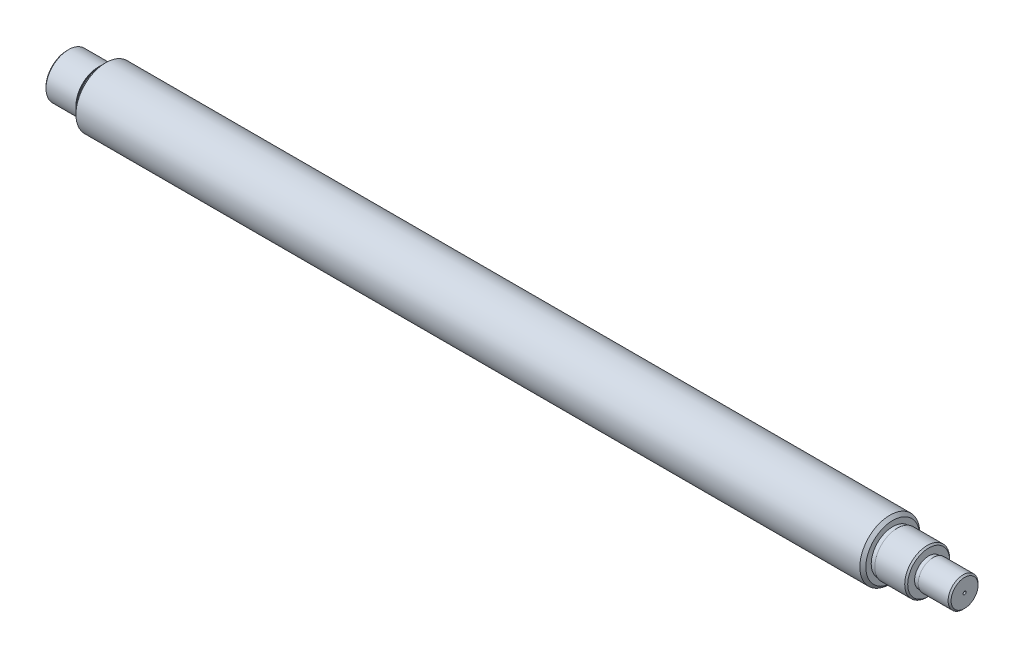
from build123d import *

# Parameters (mm, degrees)
CHAMFER1_SIZE = 0.5
SKETCH3_W     = 1.5
SKETCH3_H     = 0.3


with BuildPart() as part:
    # Sketch1 → Revolve1 (revolve)
    with BuildSketch(Plane.XY):
        Polygon((0, 0), (0, 7.5), (12, 7.5), (12, 9), (13, 10), (275, 10), (276, 9), (276, 7.5), (288, 7.5), (288, 5), (300, 5), (300, 0), align=None)
    revolve(axis=Axis((0, 0, 0), (1, 0, 0)))

    # Chamfer1
    chamfer1_edges = [part.edges().sort_by_distance(p)[0] for p in [
        (300, -5, 0),
        (288, -7.5, 0),
        (0, -7.5, 0),
    ]]
    chamfer(chamfer1_edges, length=CHAMFER1_SIZE)

    # Sketch2 → Cut-Revolve1 (revolve, cut)
    with BuildSketch(Plane.XY):
        Polygon((0, 0), (0, 0.5), (0.5, 0), align=None)
        Polygon((300, 0), (300, 0.5), (299.5, 0), align=None)
    revolve(axis=Axis((0, 0, 0), (1, 0, 0)), mode=Mode.SUBTRACT)

    # Sketch3 → Cut-Revolve2 (revolve, cut)
    with BuildSketch(Plane.XY):
        with Locations((11.25, 7.35)):
            Rectangle(SKETCH3_W, SKETCH3_H)
        with Locations((276.75, 7.35)):
            Rectangle(SKETCH3_W, SKETCH3_H)
        with Locations((288.75, 4.85)):
            Rectangle(SKETCH3_W, SKETCH3_H)
    revolve(axis=Axis((0, 0, 0), (1, 0, 0)), mode=Mode.SUBTRACT)


solid = part.part
